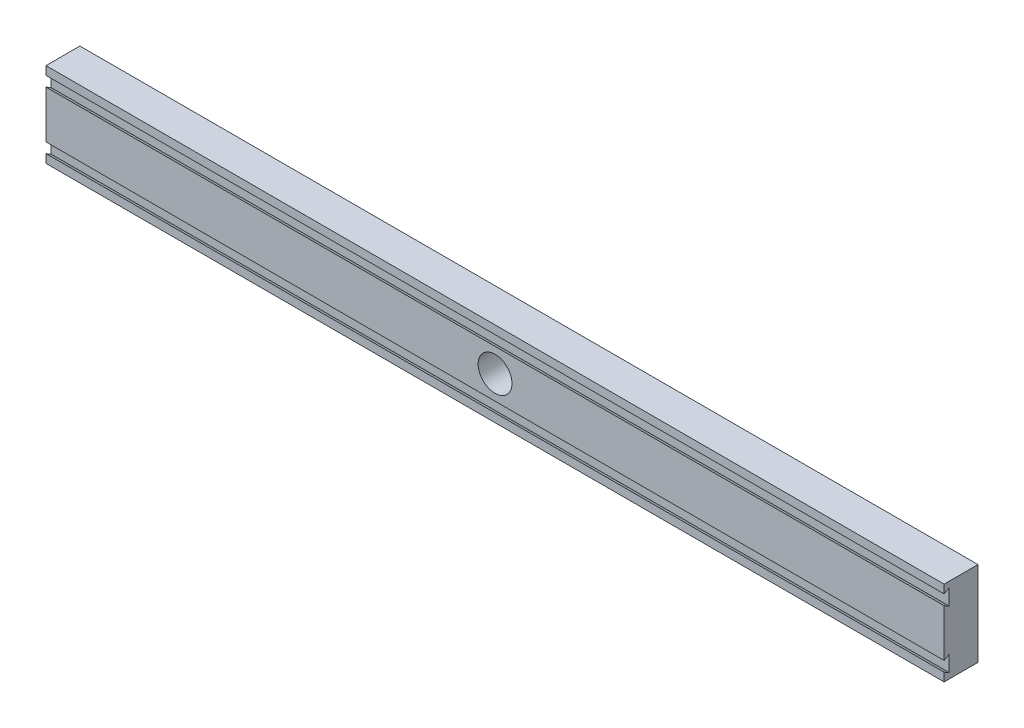
from build123d import *

# Parameters (mm, degrees)
BOSS_EXTRUDE1_DEPTH     = 265
CUT_EXTRUDE2_DEPTH      = 267.364412037
CUT_EXTRUDE2_DEPTH_BACK = 267.364412037
SKETCH3_R               = 10
SCALE2_SCALE            = 0.2004


with BuildPart() as part:
    # Sketch2 → Boss-Extrude1 (new, symmetric)
    with BuildSketch(Plane(origin=(0, 0, 0), x_dir=(0, 0, -1), z_dir=(1, 0, 0))):
        Polygon((-10, -20), (-10, -25), (10, -25), (10, 25), (-10, 25), (-10, 20), (-7, 21.732050808), (-7, 12.267949192), (-10, 14), (-10, -14), (-7, -12.267949192), (-7, -21.732050808), align=None)
    extrude(amount=BOSS_EXTRUDE1_DEPTH, both=True)

    # Sketch3 → Cut-Extrude2 (cut, two sides: drawn at the far end of the back side and taken through both)
    with BuildSketch(Plane.XY.offset(-CUT_EXTRUDE2_DEPTH_BACK)):
        Circle(SKETCH3_R)
    extrude(amount=CUT_EXTRUDE2_DEPTH + CUT_EXTRUDE2_DEPTH_BACK, mode=Mode.SUBTRACT)


with BuildPart() as part_1:
    # Scale2: scaled about (0, 0, -0.413206639)
    add(part.part.scale(SCALE2_SCALE).moved(Location((0, 0, -0.330400029))))


solid = part_1.part
